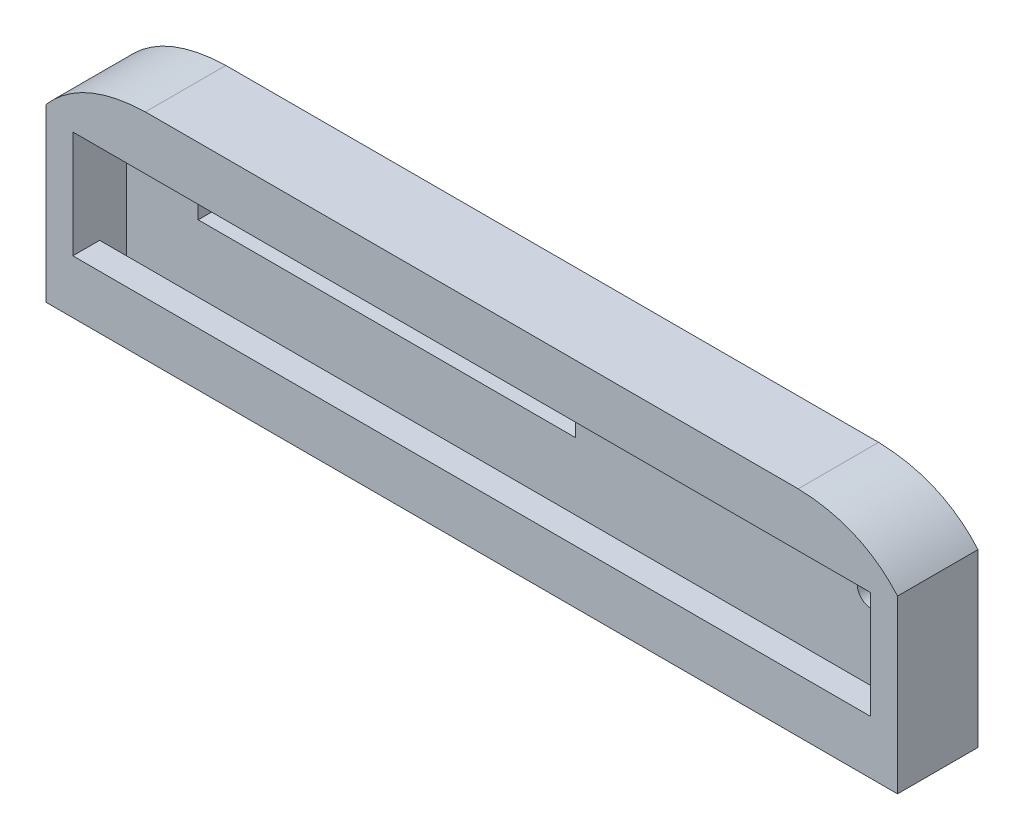
from build123d import *

# Parameters (mm, degrees)
SKETCH1_W           = 63.5
SKETCH1_H           = 16
BOSS_EXTRUDE1_DEPTH = 2
SKETCH2_W           = 63.5
SKETCH2_H           = 16
SKETCH2_W_2         = 59.5
SKETCH2_H_2         = 12
BOSS_EXTRUDE2_DEPTH = 2
SKETCH4_W           = 63.5
SKETCH4_H           = 16
SKETCH4_W_2         = 59.5
SKETCH4_H_2         = 8
BOSS_EXTRUDE3_DEPTH = 2
SKETCH6_R           = 1
CUT_EXTRUDE2_DEPTH  = 33.985792396
SKETCH7_W           = 28.15
SKETCH7_H           = 2
CUT_EXTRUDE3_DEPTH  = 34.287572756
CUT_EXTRUDE4_DEPTH  = 34.287572756


with BuildPart() as part:
    # Sketch1 → Boss-Extrude1 (new body)
    with BuildSketch(Plane.XY):
        Rectangle(SKETCH1_W, SKETCH1_H)
    extrude(amount=BOSS_EXTRUDE1_DEPTH)

    # Sketch2 → Boss-Extrude2 (add)
    with BuildSketch(Plane.XY.offset(2)):
        Rectangle(SKETCH2_W, SKETCH2_H)
        Rectangle(SKETCH2_W_2, SKETCH2_H_2, mode=Mode.SUBTRACT)
    extrude(amount=BOSS_EXTRUDE2_DEPTH)

    # Sketch4 → Boss-Extrude3 (add)
    with BuildSketch(Plane.XY.offset(4)):
        Rectangle(SKETCH4_W, SKETCH4_H)
        Rectangle(SKETCH4_W_2, SKETCH4_H_2, mode=Mode.SUBTRACT)
    extrude(amount=BOSS_EXTRUDE3_DEPTH)

    # Sketch6 → Cut-Extrude2 (cut, through all)
    with BuildSketch(Plane.XY.offset(2)):
        with Locations((25.75, 0)):
            Circle(SKETCH6_R)
    extrude(amount=-CUT_EXTRUDE2_DEPTH, mode=Mode.SUBTRACT)

    # Sketch7 → Cut-Extrude3 (cut, through all)
    with BuildSketch(Plane(origin=(0, 0, 0), x_dir=(-1, 0, 0), z_dir=(0, 0, -1))):
        with Locations((10.325, 0)):
            Rectangle(SKETCH7_W, SKETCH7_H)
    extrude(amount=-CUT_EXTRUDE3_DEPTH, mode=Mode.SUBTRACT)

    # Sketch8 → Cut-Extrude4 (cut, through all)
    with BuildSketch(Plane(origin=(0, 0, 0), x_dir=(-1, 0, 0), z_dir=(0, 0, -1))):
        with BuildLine():
            add(Edge.make_bspline(
                [(24.340057871, 8), (29.079374102, 7.859454073), (31.75, 4.777235297)],
                knots=[0.087220719, 0.087220719, 0.087220719, 1, 1, 1], degree=2))
            Line((31.75, 4.777235297), (31.75, 8))
            Line((31.75, 8), (24.340057871, 8))
        make_face()
    cut_extrude4 = extrude(amount=-CUT_EXTRUDE4_DEPTH, mode=Mode.SUBTRACT)

    # Mirror1: Cut-Extrude4 across plane
    add(cut_extrude4.mirror(Plane(origin=(0, 0, 0), x_dir=(0, 0, 1), z_dir=(1, 0, 0))), mode=Mode.SUBTRACT)


solid = part.part
